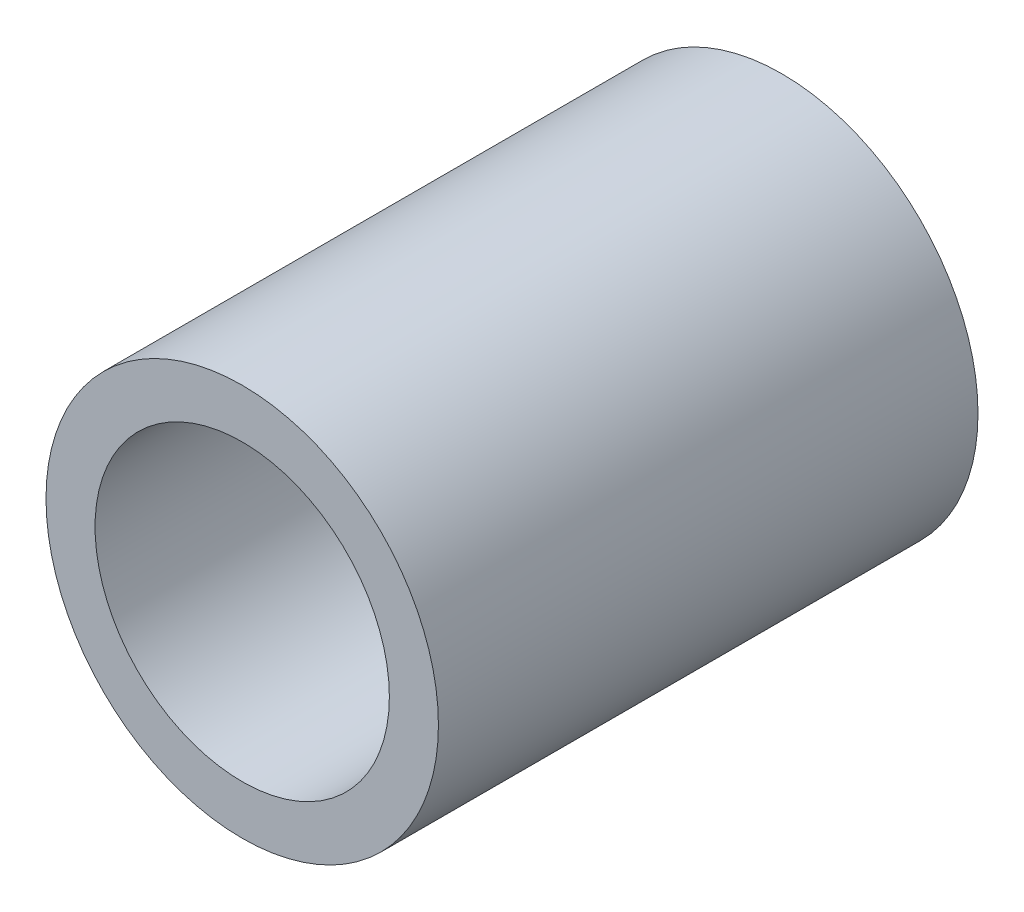
from build123d import *

# Parameters (mm, degrees)
IZIM1_R                     = 40
IZIM1_R_2                   = 30
Y_KSEKLIK_EKSTR_ZYON1_DEPTH = 110


with BuildPart() as part:
    # Çizim1 → Yükseklik-Ekstrüzyon1 (new body)
    with BuildSketch(Plane.XY):
        Circle(IZIM1_R)
        Circle(IZIM1_R_2, mode=Mode.SUBTRACT)
    extrude(amount=Y_KSEKLIK_EKSTR_ZYON1_DEPTH)


solid = part.part
